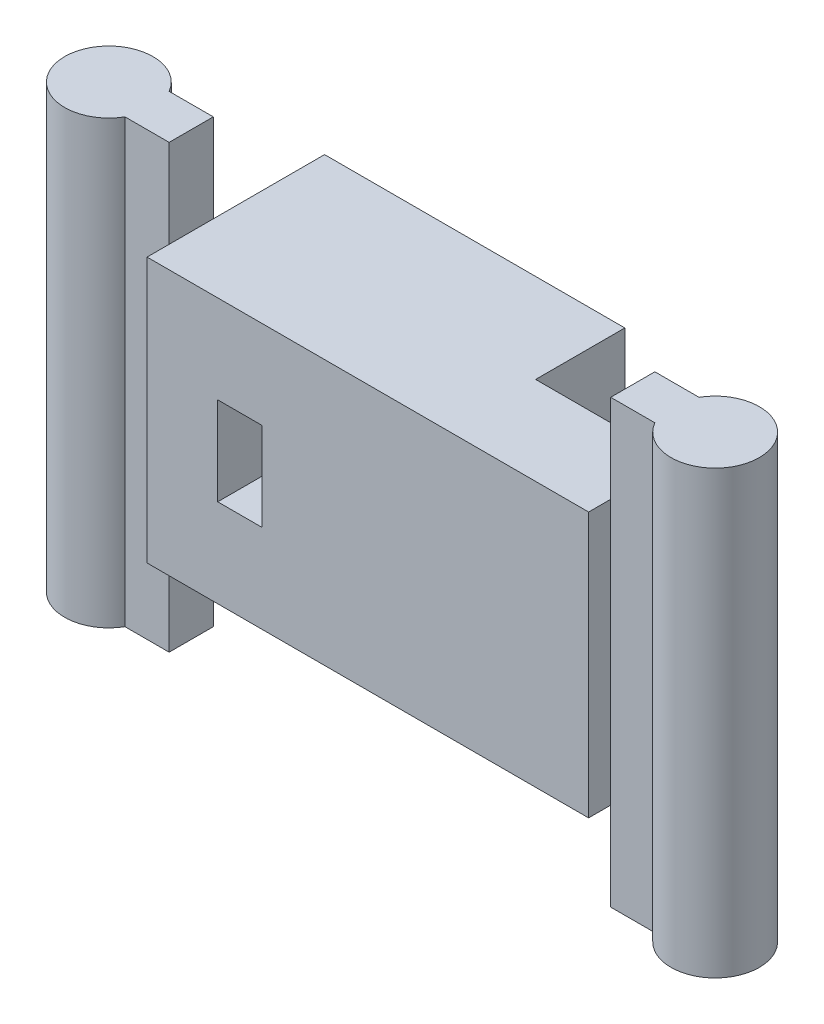
from build123d import *

# Parameters (mm, degrees)
ESBO_O1_W                = 34
ESBO_O1_H                = 30
ESBO_O1_W_2              = 5
ESBO_O1_H_2              = 10
RESSALTO_EXTRUS_O1_DEPTH = 20.1
ESBO_O2_W                = 10
ESBO_O2_H                = 30
RESSALTO_EXTRUS_O2_DEPTH = 16
RESSALTO_EXTRUS_O3_DEPTH = 50


with BuildPart() as part:
    # Esboço1 → Ressalto-extrusão1 (new body)
    with BuildSketch(Plane.XY):
        Rectangle(ESBO_O1_W, ESBO_O1_H)
        with Locations((-6.5, 0)):
            Rectangle(ESBO_O1_W_2, ESBO_O1_H_2, mode=Mode.SUBTRACT)
    extrude(amount=RESSALTO_EXTRUS_O1_DEPTH)

    # Esboço2 → Ressalto-extrusão2 (add)
    with BuildSketch(Plane(origin=(17, 0, 0), x_dir=(0, 0, -1), z_dir=(1, 0, 0))):
        with Locations((-15.1, 0)):
            Rectangle(ESBO_O2_W, ESBO_O2_H)
    extrude(amount=RESSALTO_EXTRUS_O2_DEPTH)

    # Esboço3 → Ressalto-extrusão3 (add)
    with BuildSketch(Plane(origin=(0, 25, 0), x_dir=(1, 0, 0), z_dir=(0, 1, 0))):
        with BuildLine():
            Line((33, -12.6), (38, -12.6))
            ThreePointArc((38, -12.6), (47.330127019, -15.1), (38, -17.6))
            Line((38, -17.6), (33, -17.6))
            Line((33, -17.6), (33, -12.6))
        make_face()
        with BuildLine():
            Line((-17, -12.6), (-17, -17.6))
            Line((-17, -17.6), (-22, -17.6))
            ThreePointArc((-22, -17.6), (-31.330127019, -15.1), (-22, -12.6))
            Line((-22, -12.6), (-17, -12.6))
        make_face()
    extrude(amount=-RESSALTO_EXTRUS_O3_DEPTH)


solid = part.part
